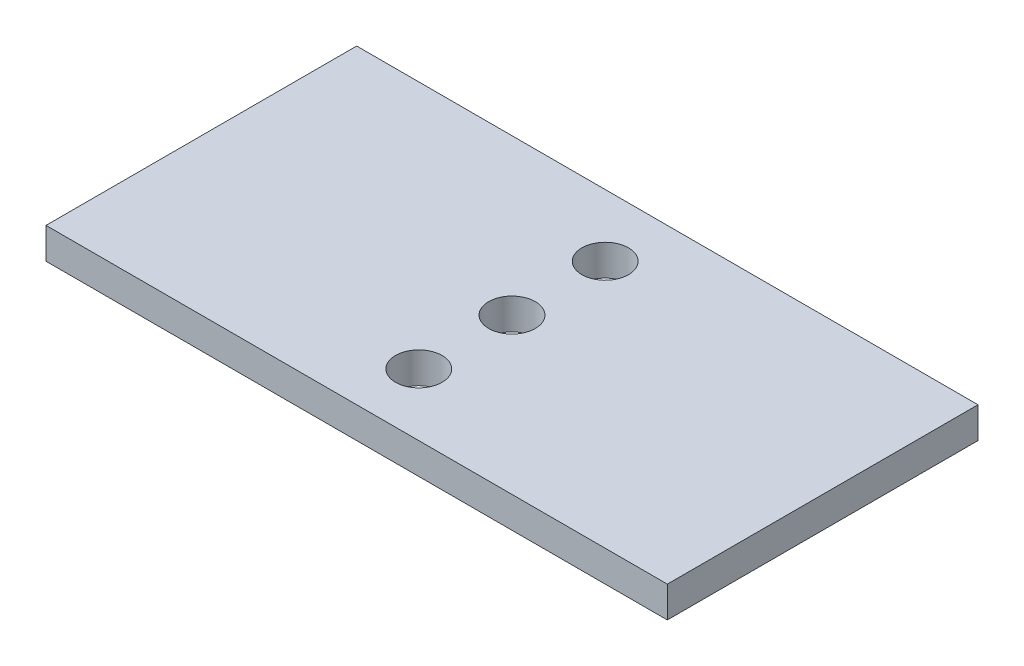
from build123d import *

# Parameters (mm, degrees)
SKETCH2_W           = 200
SKETCH2_H           = 100
SKETCH2_R           = 7.5
BOSS_EXTRUDE1_DEPTH = 10


with BuildPart() as part:
    # Sketch2 → Boss-Extrude1 (new body)
    with BuildSketch(Plane(origin=(0, 0, 0), x_dir=(1, 0, 0), z_dir=(0, 1, 0))):
        Rectangle(SKETCH2_W, SKETCH2_H)
        with Locations(Location((0, 0, 0), (0, 0, 270))):
            Circle(SKETCH2_R, mode=Mode.SUBTRACT)
        with Locations(Location((0, 30, 0), (0, 0, 270))):
            Circle(SKETCH2_R, mode=Mode.SUBTRACT)
        with Locations(Location((0, -30, 0), (0, 0, 270))):
            Circle(SKETCH2_R, mode=Mode.SUBTRACT)
    extrude(amount=BOSS_EXTRUDE1_DEPTH)


solid = part.part
